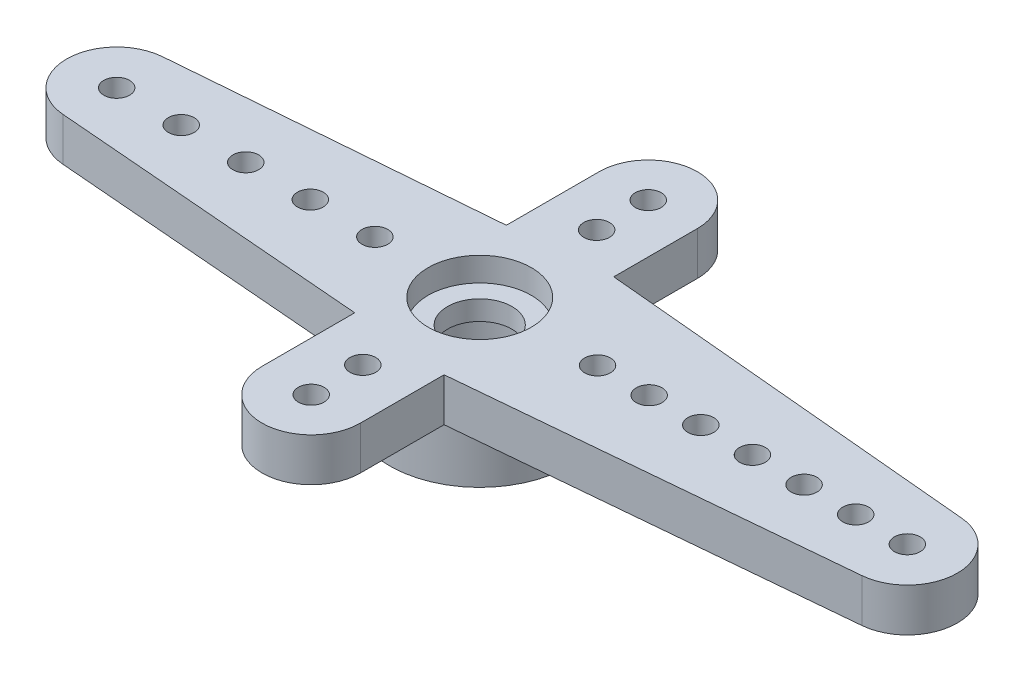
from build123d import *

# Parameters (mm, degrees)
BOSS_EXTRUDE1_START = -1.675
SKETCH2_R           = 0.5
BOSS_EXTRUDE1_DEPTH = 1.675
CIRPATTERN1_COUNT   = 2
SKETCH3_R           = 0.5
BOSS_EXTRUDE2_DEPTH = 1.675
SKETCH4_R           = 0.5
BOSS_EXTRUDE3_DEPTH = 1.675


with BuildPart() as part:
    # Sketch1 → Revolve1 (revolve)
    with BuildSketch(Plane.XY, mode=Mode.PRIVATE) as revolve1_sk:
        Polygon((2.25, 0), (1.25, 0), (1.25, 0.76), (2, 0.76), (2, 1.69), (3.5, 1.69), (3.5, -2.21), (2.25, -2.21), align=None)
    revolve(revolve1_sk.sketch.rotate(Axis((0, 0, 0), (0, -1, 0)), 180), axis=Axis((0, 0, 0), (0, -1, 0)))

    # Sketch2 → Boss-Extrude1 (add)
    with BuildSketch(Plane(origin=(0, 1.69, 0), x_dir=(1, 0, 0), z_dir=(0, 1, 0)).offset(BOSS_EXTRUDE1_START)):
        with BuildLine():
            Line((-1.905, 6.5278), (-1.905, 2.93614969))
            ThreePointArc((-1.905, 2.93614969), (0, 3.5), (1.905, 2.93614969))
            Line((1.905, 2.93614969), (1.905, 6.5278))
            ThreePointArc((1.905, 6.5278), (0, 8.4328), (-1.905, 6.5278))
        make_face()
        with Locations(Location((0, 6.5278, 0), (0, 0, 180))):
            Circle(SKETCH2_R, mode=Mode.SUBTRACT)
        with Locations(Location((0, 4.5278, 0), (0, 0, 180))):
            Circle(SKETCH2_R, mode=Mode.SUBTRACT)
    boss_extrude1 = extrude(amount=BOSS_EXTRUDE1_DEPTH)

    # CirPattern1: Boss-Extrude1 ×2 about axis
    cirpattern1_axis = Axis((0, 0, 0), (0, 1, 0))
    for i in range(1, CIRPATTERN1_COUNT):
        add(boss_extrude1.rotate(cirpattern1_axis, i * 360 / CIRPATTERN1_COUNT))

    # Sketch3 → Boss-Extrude2 (add)
    with BuildSketch(Plane.XZ.offset(-0.015)):
        with BuildLine():
            Line((0.927024811, -3.375), (16.738893675, -1.929453741))
            ThreePointArc((16.738893675, -1.929453741), (18.5, 0), (16.738893675, 1.929453741))
            Line((16.738893675, 1.929453741), (0.927024811, 3.375))
            ThreePointArc((0.927024811, 3.375), (3.5, 0), (0.927024811, -3.375))
        make_face()
        with Locations((16.562499938, 0)):
            Circle(SKETCH3_R, mode=Mode.SUBTRACT)
        with Locations((14.562499938, 0)):
            Circle(SKETCH3_R, mode=Mode.SUBTRACT)
        with Locations((12.562499938, 0)):
            Circle(SKETCH3_R, mode=Mode.SUBTRACT)
        with Locations((10.562499938, 0)):
            Circle(SKETCH3_R, mode=Mode.SUBTRACT)
        with Locations((8.562499938, 0)):
            Circle(SKETCH3_R, mode=Mode.SUBTRACT)
        with Locations((6.562499938, 0)):
            Circle(SKETCH3_R, mode=Mode.SUBTRACT)
        with Locations((4.562499938, 0)):
            Circle(SKETCH3_R, mode=Mode.SUBTRACT)
    extrude(amount=-BOSS_EXTRUDE2_DEPTH)

    # Sketch4 → Boss-Extrude3 (add)
    with BuildSketch(Plane.XZ.offset(-0.015)):
        with BuildLine():
            Line((-1.905, 2.93614969), (-14.220100787, 1.931079611))
            ThreePointArc((-14.220100787, 1.931079611), (-16, 0), (-14.220100787, -1.931079611))
            Line((-14.220100787, -1.931079611), (-1.905, -2.93614969))
            ThreePointArc((-1.905, -2.93614969), (-3.5, 0), (-1.905, 2.93614969))
        make_face()
        with Locations((-14.062499938, 0)):
            Circle(SKETCH4_R, mode=Mode.SUBTRACT)
        with Locations((-11.562499938, 0)):
            Circle(SKETCH4_R, mode=Mode.SUBTRACT)
        with Locations((-9.062499938, 0)):
            Circle(SKETCH4_R, mode=Mode.SUBTRACT)
        with Locations((-6.562499938, 0)):
            Circle(SKETCH4_R, mode=Mode.SUBTRACT)
        with Locations((-4.062499938, 0)):
            Circle(SKETCH4_R, mode=Mode.SUBTRACT)
    extrude(amount=-BOSS_EXTRUDE3_DEPTH)


solid = part.part
